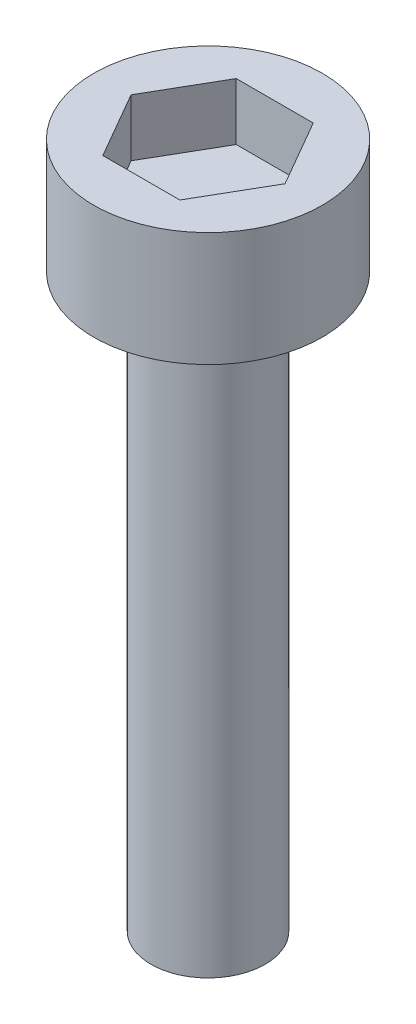
from build123d import *

# Parameters (mm, degrees)
CUT_EXTRUDE1_DEPTH = 3


with BuildPart() as part:
    # Sketch1 → Revolve1 (revolve)
    with BuildSketch(Plane.XY, mode=Mode.PRIVATE) as revolve1_sk:
        Polygon((0, 0), (3, 0), (3, 30), (6, 30), (6, 36), (0, 36), align=None)
    revolve(revolve1_sk.sketch.rotate(Axis((0, 0, 0), (0, 1, 0)), 90), axis=Axis((0, 0, 0), (0, 1, 0)))

    # Sketch2 → Cut-Extrude1 (cut)
    with BuildSketch(Plane(origin=(0, 36, 0), x_dir=(1, 0, 0), z_dir=(0, 1, 0))):
        Polygon((2.020725942, 3.5), (-2.020725942, 3.5), (-4.041451884, 0), (-2.020725942, -3.5), (2.020725942, -3.5), (4.041451884, 0), align=None)
    extrude(amount=-CUT_EXTRUDE1_DEPTH, mode=Mode.SUBTRACT)


solid = part.part
